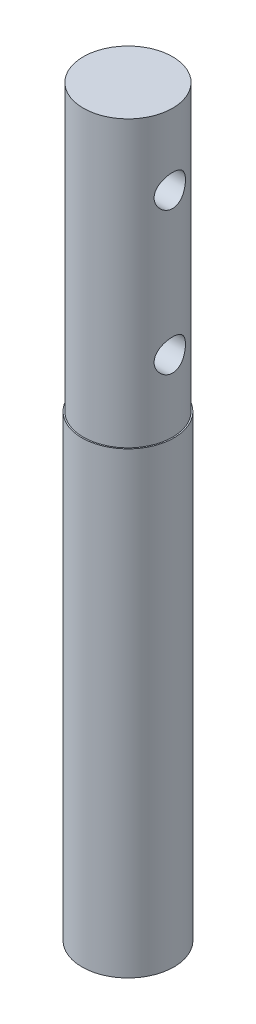
from build123d import *

# Parameters (mm, degrees)
SKETCH1_R               = 32.25
BOSS_EXTRUDE1_DEPTH     = 321.7
SKETCH2_R               = 31.34
BOSS_EXTRUDE2_DEPTH     = 200
CUT_EXTRUDE1_DEPTH      = 524.689807997
CUT_EXTRUDE1_DEPTH_BACK = 524.689807997
SKETCH3_R               = 11


with BuildPart() as part:
    # Sketch1 → Boss-Extrude1 (new body)
    with BuildSketch(Plane(origin=(0, 0, 0), x_dir=(1, 0, 0), z_dir=(0, 1, 0))):
        with Locations(Location((0, 0, 0), (0, 0, 270))):
            Circle(SKETCH1_R)
    extrude(amount=BOSS_EXTRUDE1_DEPTH)

    # Sketch2 → Boss-Extrude2 (add)
    with BuildSketch(Plane(origin=(0, 321.7, 0), x_dir=(1, 0, 0), z_dir=(0, 1, 0))):
        with Locations(Location((0, 0, 0), (0, 0, 270))):
            Circle(SKETCH2_R)
    extrude(amount=BOSS_EXTRUDE2_DEPTH)

    # Sketch3 → Cut-Extrude1 (cut, two sides: drawn at the far end of the back side and taken through both)
    with BuildSketch(Plane(origin=(0, 0, 0), x_dir=(0, 0, -1), z_dir=(1, 0, 0)).offset(-CUT_EXTRUDE1_DEPTH_BACK)):
        with Locations((0, 471.7)):
            Circle(SKETCH3_R)
        with Locations((0, 371.7)):
            Circle(SKETCH3_R)
    extrude(amount=CUT_EXTRUDE1_DEPTH + CUT_EXTRUDE1_DEPTH_BACK, mode=Mode.SUBTRACT)


solid = part.part
